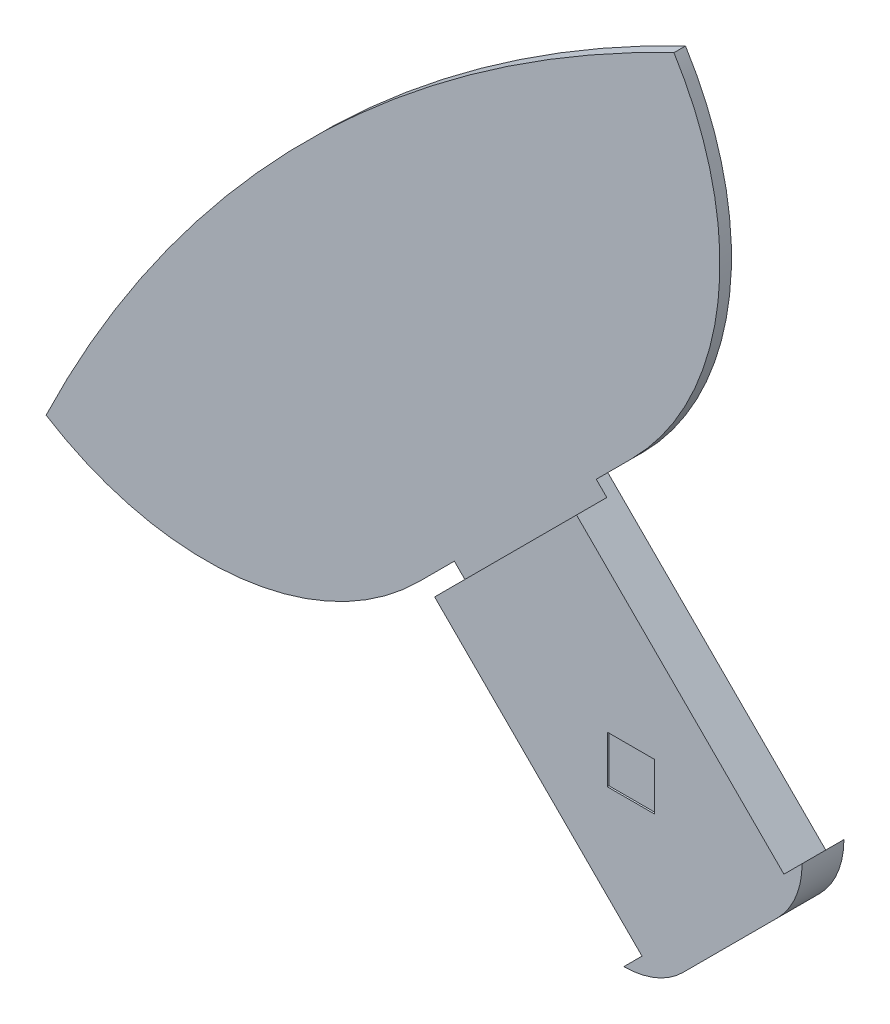
from build123d import *

# Parameters (mm, degrees)
BOSS_EXTRUDE2_DEPTH = 5
CUT_EXTRUDE1_START  = 5
SKETCH3_W           = 19.008841094
SKETCH3_H           = 2.1
SKETCH3_W_2         = 12
SKETCH3_W_3         = 1.535533906
SKETCH3_W_4         = 1.464466094
SKETCH3_W_5         = 17.544375
CUT_EXTRUDE1_DEPTH  = 16
CUT_EXTRUDE2_DEPTH  = 52
SKETCH5_W           = 1.05
SKETCH5_H           = 46.149322856
CUT_EXTRUDE3_DEPTH  = 10
CUT_EXTRUDE4_START  = -0.76
CUT_EXTRUDE4_DEPTH  = 0.76
SKETCH7_W           = 2.828427125
SKETCH7_H           = 2.828427125
CUT_EXTRUDE5_DEPTH  = 0.1


with BuildPart() as part:
    # Sketch1 → Boss-Extrude2 (new body)
    with BuildSketch(Plane.XY):
        Polygon((-39.238867065, 47.72414844), (-47.72414844, 39.238867065), (-34.69381669, 26.208535316), (-26.208535316, 34.69381669), align=None)
        with BuildLine():
            ThreePointArc((-49.845468783, 62.573390845), (-56.568542495, 56.568542495), (-62.573390845, 49.845468783))
            Line((-62.573390845, 49.845468783), (-49.845468783, 37.117546722))
            Line((-49.845468783, 37.117546722), (-47.72414844, 39.238867065))
            Line((-47.72414844, 39.238867065), (-39.238867065, 47.72414844))
            Line((-39.238867065, 47.72414844), (-37.117546722, 49.845468783))
            Line((-37.117546722, 49.845468783), (-49.845468783, 62.573390845))
        make_face()
        with BuildLine():
            ThreePointArc((-34.594119865, 72.133534994), (-42.489529555, 67.783772971), (-49.845468783, 62.573390845))
            Line((-49.845468783, 62.573390845), (-37.117546722, 49.845468783))
            ThreePointArc((-37.117546722, 49.845468783), (-31.959737739, 60.548390845), (-34.594119865, 72.133534994))
        make_face()
        with BuildLine():
            ThreePointArc((-62.573390845, 49.845468783), (-67.783772971, 42.489529555), (-72.133534994, 34.594119865))
            ThreePointArc((-72.133534994, 34.594119865), (-60.548390845, 31.959737739), (-49.845468783, 37.117546722))
            Line((-49.845468783, 37.117546722), (-62.573390845, 49.845468783))
        make_face()
        with BuildLine():
            Line((-34.69381669, 26.208535316), (-35.779603128, 25.122748879))
            ThreePointArc((-35.779603128, 25.122748879), (-33.866185966, 25.503351216), (-32.244069222, 26.587214973))
            Line((-32.244069222, 26.587214973), (-26.587214973, 32.244069222))
            ThreePointArc((-26.587214973, 32.244069222), (-25.503351216, 33.866185966), (-25.122748879, 35.779603128))
            Line((-25.122748879, 35.779603128), (-26.208535316, 34.69381669))
            Line((-26.208535316, 34.69381669), (-34.69381669, 26.208535316))
        make_face()
    extrude(amount=BOSS_EXTRUDE2_DEPTH)

    # Sketch3 → Cut-Extrude1 (cut)
    with BuildSketch(Plane(origin=(-57.699913345, 57.699913345, 0), x_dir=(-0.707106781186549, -0.7071067811865461, 0), z_dir=(0.7071067811865461, -0.707106781186549, 0)).offset(CUT_EXTRUDE1_START)):
        with Locations((-17.039954453, -2.5)):
            Rectangle(SKETCH3_W, SKETCH3_H)
        with Locations((0, -2.5)):
            Rectangle(SKETCH3_W_2, SKETCH3_H)
        with Locations((-6.767766953, -2.5)):
            Rectangle(SKETCH3_W_3, SKETCH3_H)
        with Locations((6.767766953, -2.5)):
            Rectangle(SKETCH3_W_3, SKETCH3_H)
        with Locations((8.267766953, -2.5)):
            Rectangle(SKETCH3_W_4, SKETCH3_H)
        with Locations((17.7721875, -2.5)):
            Rectangle(SKETCH3_W_5, SKETCH3_H)
    extrude(amount=CUT_EXTRUDE1_DEPTH, mode=Mode.SUBTRACT)

    # Sketch4 → Cut-Extrude2 (cut)
    with BuildSketch(Plane(origin=(-57.699913345, 57.699913345, 0), x_dir=(-0.707106781186549, -0.7071067811865461, 0), z_dir=(0.7071067811865461, -0.707106781186549, 0))):
        Polygon((-7.535533906, -2.5), (27.054152634, -2.5), (27.054152634, -6.972921607), (-28.074504585, -6.972921607), (-28.074504585, -2.5), align=None)
    extrude(amount=CUT_EXTRUDE2_DEPTH, mode=Mode.SUBTRACT)

    # Sketch5 → Cut-Extrude3 (cut)
    with BuildSketch(Plane(origin=(-54.164379439, 54.164379439, 0), x_dir=(0, 0, -1), z_dir=(0.7071067811865461, -0.7071067811865489, 0))):
        with Locations((-1.975, 0)):
            Rectangle(SKETCH5_W, SKETCH5_H)
    extrude(amount=-CUT_EXTRUDE3_DEPTH, mode=Mode.SUBTRACT)

    # Sketch6 → Cut-Extrude4 (cut)
    with BuildSketch(Plane.XY.offset(1.45).offset(CUT_EXTRUDE4_START)):
        with BuildLine():
            Line((-47.72414844, 39.238867065), (-49.845468783, 37.117546722))
            ThreePointArc((-49.845468783, 37.117546722), (-60.548390845, 31.959737739), (-72.133534994, 34.594119865))
            ThreePointArc((-72.133534994, 34.594119865), (-56.568542495, 56.568542495), (-34.594119865, 72.133534994))
            ThreePointArc((-34.594119865, 72.133534994), (-31.959737739, 60.548390845), (-37.117546722, 49.845468783))
            Line((-37.117546722, 49.845468783), (-39.238867065, 47.72414844))
            Line((-39.238867065, 47.72414844), (-38.608030253, 47.093311627))
            Line((-38.608030253, 47.093311627), (-47.093311627, 38.608030253))
            Line((-47.093311627, 38.608030253), (-47.72414844, 39.238867065))
        make_face()
    extrude(amount=CUT_EXTRUDE4_DEPTH, mode=Mode.SUBTRACT)

    # Sketch7 → Cut-Extrude5 (cut)
    with BuildSketch(Plane.XY.offset(2.5)):
        with Locations((-35.355339059, 35.355339059)):
            Rectangle(SKETCH7_W, SKETCH7_H)
    extrude(amount=-CUT_EXTRUDE5_DEPTH, mode=Mode.SUBTRACT)


solid = part.part
